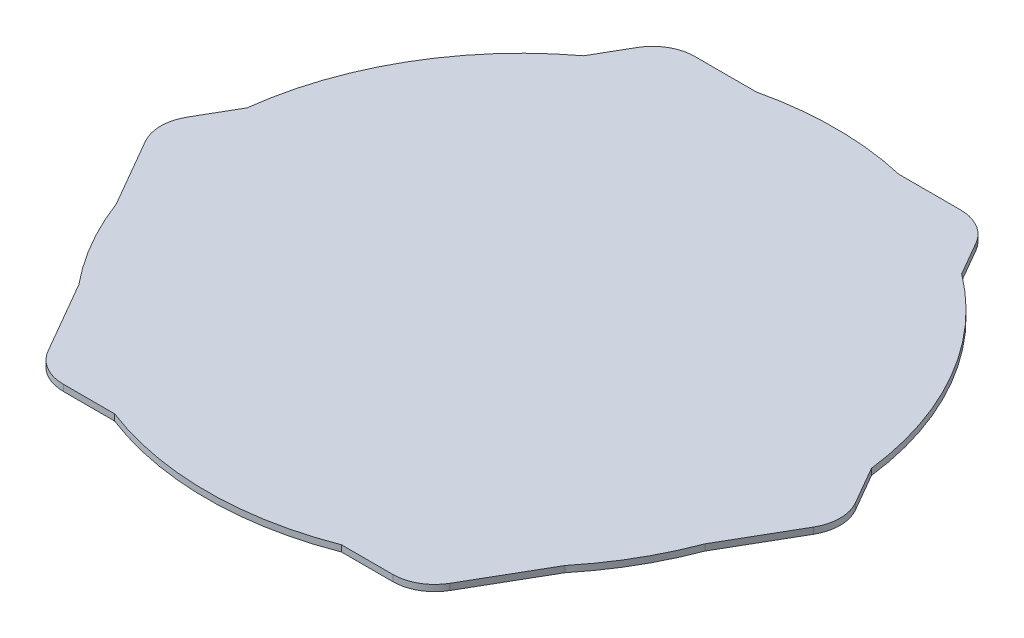
from build123d import *

# Parameters (mm, degrees)
EXTRUDE_1_DEPTH     = 5
FILLET_1_R          = 20
EXTRUDE_START       = 3
EXTRUDE_2_DEPTH     = 3
SKETCH_5_W          = 424.898907654
SKETCH_5_H          = 342.867142677
CUT_EXTRUDE_2_DEPTH = 13


with BuildPart() as part:
    # 草圖1 → 填料-伸長1 (new body)
    with BuildSketch(Plane(origin=(0, 0, 0), x_dir=(1, 0, 0), z_dir=(0, 1, 0))):
        Polygon((-90.122176988, 0), (90.122176988, 0), (165.122176988, 129.903810568), (75, 286), (-75, 286), (-165.122176988, 129.903810568), align=None)
    extrude(amount=EXTRUDE_1_DEPTH)

    # 圓角1
    fillet_1_edges = [part.edges().sort_by_distance(p)[0] for p in [
        (-165.122176988, 2.5, -129.903810568),
        (-75, 2.5, -286),
        (75, 2.5, -286),
        (165.122176988, 2.5, -129.903810568),
        (90.122176988, 2.5, 0),
        (-90.122176988, 2.5, 0),
    ]]
    fillet(fillet_1_edges, radius=FILLET_1_R)

    # 草圖3 → 填料-伸長2 (add)
    with BuildSketch(Plane(origin=(0, 5, 0), x_dir=(1, 0, 0), z_dir=(0, 1, 0)).offset(EXTRUDE_START)):
        with BuildLine():
            Line((-159.348674296, 119.903810568), (-140.378315376, 87.04618508))
            ThreePointArc((-140.378315376, 87.04618508), (-129.903810568, 64.903810568), (-115.965204144, 44.761436056))
            Line((-115.965204144, 44.761436056), (-95.89567968, 10))
            ThreePointArc((-95.89567968, 10), (-88.575171604, 2.679491924), (-78.575171604, 0))
            Line((-78.575171604, 0), (-54.101051641, 0))
            ThreePointArc((-54.101051641, 0), (0, -10.096189432), (54.101051641, 0))
            Line((54.101051641, 0), (78.575171604, 0))
            ThreePointArc((78.575171604, 0), (88.575171604, 2.679491924), (95.89567968, 10))
            Line((95.89567968, 10), (115.965204144, 44.761436056))
            ThreePointArc((115.965204144, 44.761436056), (129.903810568, 64.903810568), (140.378315376, 87.04618508))
            Line((140.378315376, 87.04618508), (159.348674296, 119.903810568))
            ThreePointArc((159.348674296, 119.903810568), (162.028166221, 129.903810568), (159.348674296, 139.903810568))
            Line((159.348674296, 139.903810568), (148.905382636, 157.992122322))
            ThreePointArc((148.905382636, 157.992122322), (129.903810568, 214.903810568), (90.117628809, 259.815498813))
            Line((90.117628809, 259.815498813), (80.773502692, 276))
            ThreePointArc((80.773502692, 276), (73.452994616, 283.320508076), (63.452994616, 286))
            Line((63.452994616, 286), (33.998579873, 286))
            ThreePointArc((33.998579873, 286), (0, 289.903810568), (-33.998579873, 286))
            Line((-33.998579873, 286), (-63.452994616, 286))
            ThreePointArc((-63.452994616, 286), (-73.452994616, 283.320508076), (-80.773502692, 276))
            Line((-80.773502692, 276), (-90.117628809, 259.815498813))
            ThreePointArc((-90.117628809, 259.815498813), (-129.903810568, 214.903810568), (-148.905382636, 157.992122322))
            Line((-148.905382636, 157.992122322), (-159.348674296, 139.903810568))
            ThreePointArc((-159.348674296, 139.903810568), (-162.028166221, 129.903810568), (-159.348674296, 119.903810568))
        make_face()
    extrude(amount=-EXTRUDE_2_DEPTH)

    # 草圖5 → 除料-伸長2 (cut)
    with BuildSketch(Plane.XZ.offset(-5)):
        with Locations((0.961309746, -138.62206424)):
            Rectangle(SKETCH_5_W, SKETCH_5_H)
    extrude(amount=CUT_EXTRUDE_2_DEPTH, mode=Mode.SUBTRACT)


solid = part.part
